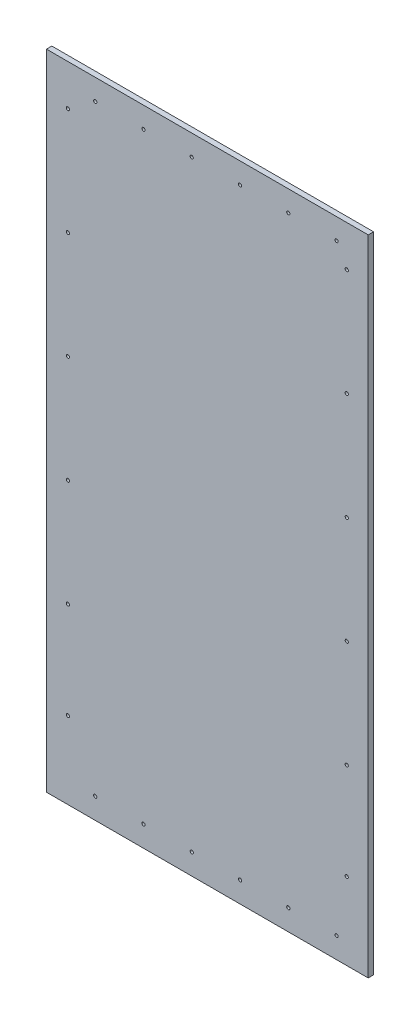
from build123d import *

# Parameters (mm, degrees)
CROQUIS1_W              = 300
CROQUIS1_H              = 600
SALIENTE_EXTRUIR1_DEPTH = 5
CROQUIS2_R              = 1.5
CORTAR_EXTRUIR1_DEPTH   = 5
CROQUIS3_R              = 1.5
CORTAR_EXTRUIR2_DEPTH   = 5


with BuildPart() as part:
    # Croquis1 → Saliente-Extruir1 (new body)
    with BuildSketch(Plane.XY):
        Rectangle(CROQUIS1_W, CROQUIS1_H)
    extrude(amount=SALIENTE_EXTRUIR1_DEPTH)

    # Croquis2 → Cortar-Extruir1 (cut)
    with BuildSketch(Plane.XY.offset(5)):
        with Locations((-104.5, 280.5)):
            Circle(CROQUIS2_R)
        with Locations((-59.5, 280.5)):
            Circle(CROQUIS2_R)
        with Locations((-14.5, 280.5)):
            Circle(CROQUIS2_R)
        with Locations((30.5, 280.5)):
            Circle(CROQUIS2_R)
        with Locations((75.5, 280.5)):
            Circle(CROQUIS2_R)
        with Locations((120.5, 280.5)):
            Circle(CROQUIS2_R)
        with Locations(Location((120.5, -280.5, 0), (0, 0, 180))):
            Circle(CROQUIS2_R)
        with Locations(Location((75.5, -280.5, 0), (0, 0, 180))):
            Circle(CROQUIS2_R)
        with Locations(Location((30.5, -280.5, 0), (0, 0, 180))):
            Circle(CROQUIS2_R)
        with Locations(Location((-14.5, -280.5, 0), (0, 0, 180))):
            Circle(CROQUIS2_R)
        with Locations(Location((-59.5, -280.5, 0), (0, 0, 180))):
            Circle(CROQUIS2_R)
        with Locations(Location((-104.5, -280.5, 0), (0, 0, 180))):
            Circle(CROQUIS2_R)
    extrude(amount=-CORTAR_EXTRUIR1_DEPTH, mode=Mode.SUBTRACT)

    # Croquis3 → Cortar-Extruir2 (cut)
    with BuildSketch(Plane.XY.offset(5)):
        with Locations((-130, 261.88)):
            Circle(CROQUIS3_R)
        with Locations((-130, 161.88)):
            Circle(CROQUIS3_R)
        with Locations((-130, 61.88)):
            Circle(CROQUIS3_R)
        with Locations((-130, -38.12)):
            Circle(CROQUIS3_R)
        with Locations((-130, -138.12)):
            Circle(CROQUIS3_R)
        with Locations((-130, -228.12)):
            Circle(CROQUIS3_R)
        with Locations(Location((130, -228.12, 0), (0, 0, 180))):
            Circle(CROQUIS3_R)
        with Locations(Location((130, -138.12, 0), (0, 0, 180))):
            Circle(CROQUIS3_R)
        with Locations(Location((130, -38.12, 0), (0, 0, 180))):
            Circle(CROQUIS3_R)
        with Locations(Location((130, 61.88, 0), (0, 0, 180))):
            Circle(CROQUIS3_R)
        with Locations(Location((130, 161.88, 0), (0, 0, 180))):
            Circle(CROQUIS3_R)
        with Locations(Location((130, 261.88, 0), (0, 0, 180))):
            Circle(CROQUIS3_R)
    extrude(amount=-CORTAR_EXTRUIR2_DEPTH, mode=Mode.SUBTRACT)


solid = part.part
